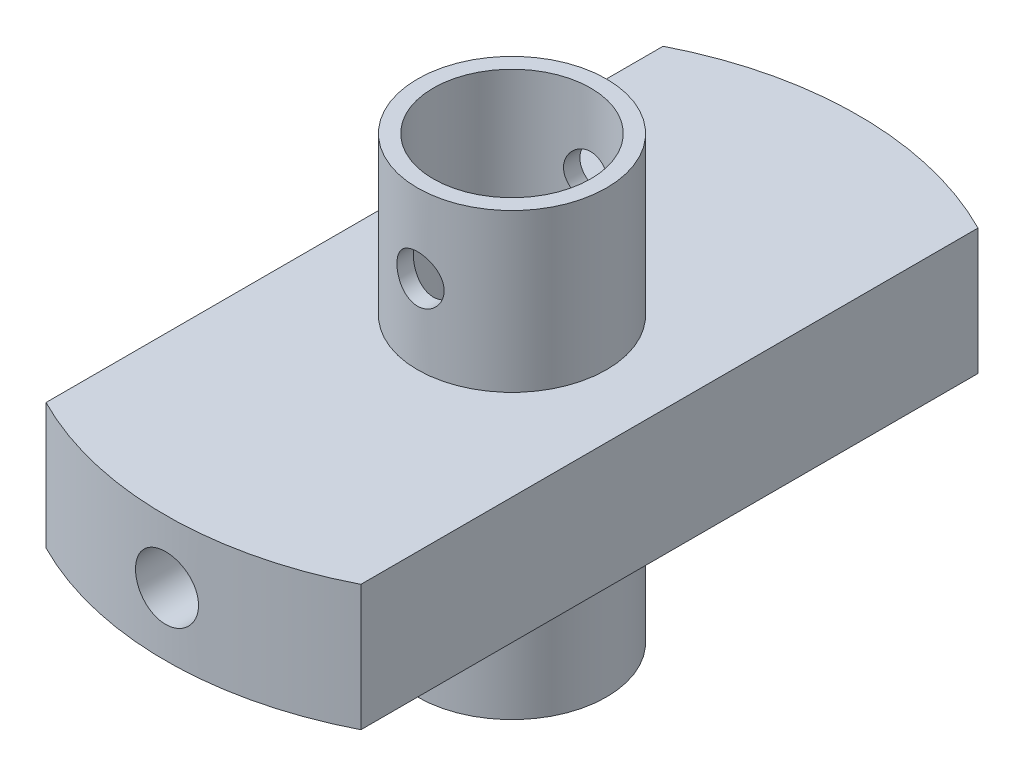
from build123d import *

# Parameters (mm, degrees)
SKETCH2_R               = 6
SKETCH2_R_2             = 5
BOSS_EXTRUDE1_DEPTH     = 10
SKETCH3_R               = 1.5
CUT_EXTRUDE1_DEPTH      = 46.299006612
CUT_EXTRUDE2_DEPTH      = 42.85689914
CUT_EXTRUDE2_DEPTH_BACK = 42.85689914
SKETCH4_R               = 2
SKETCH5_W               = 20
SKETCH5_H               = 45
CUT_EXTRUDE3_DEPTH      = 10


with BuildPart() as part:
    # Sketch1 → Revolve1 (revolve)
    with BuildSketch(Plane.XY, mode=Mode.PRIVATE) as revolve1_sk:
        Polygon((5, 0), (6, 0), (6, 10), (22, 10), (22, 18), (5, 18), (5, 13), align=None)
    revolve(revolve1_sk.sketch.rotate(Axis((0, 0, 0), (0, 1, 0)), 90), axis=Axis((0, 0, 0), (0, 1, 0)))

    # Sketch2 → Boss-Extrude1 (add)
    with BuildSketch(Plane(origin=(0, 18, 0), x_dir=(1, 0, 0), z_dir=(0, 1, 0))):
        with Locations(Location((0, 0, 0), (0, 0, 90))):
            Circle(SKETCH2_R)
        with Locations(Location((0, 0, 0), (0, 0, 90))):
            Circle(SKETCH2_R_2, mode=Mode.SUBTRACT)
    extrude(amount=BOSS_EXTRUDE1_DEPTH)

    # Sketch3 → Cut-Extrude1 (cut, through all)
    with BuildSketch(Plane(origin=(0, 0, -6), x_dir=(-1, 0, 0), z_dir=(0, 0, -1))):
        with Locations((0, 5)):
            Circle(SKETCH3_R)
        with Locations((0, 23)):
            Circle(SKETCH3_R)
    extrude(amount=-CUT_EXTRUDE1_DEPTH, mode=Mode.SUBTRACT)

    # Sketch4 → Cut-Extrude2 (cut, two sides: drawn at the far end of the back side and taken through both)
    with BuildSketch(Plane.XY.offset(-CUT_EXTRUDE2_DEPTH_BACK)):
        with Locations((0, 14)):
            Circle(SKETCH4_R)
    extrude(amount=CUT_EXTRUDE2_DEPTH + CUT_EXTRUDE2_DEPTH_BACK, mode=Mode.SUBTRACT)

    # Sketch5 → Cut-Extrude3 (cut)
    with BuildSketch(Plane.XZ.offset(-10)):
        with Locations((-20, 0)):
            Rectangle(SKETCH5_W, SKETCH5_H)
        with Locations((20, 0)):
            Rectangle(SKETCH5_W, SKETCH5_H)
    extrude(amount=-CUT_EXTRUDE3_DEPTH, mode=Mode.SUBTRACT)


solid = part.part
